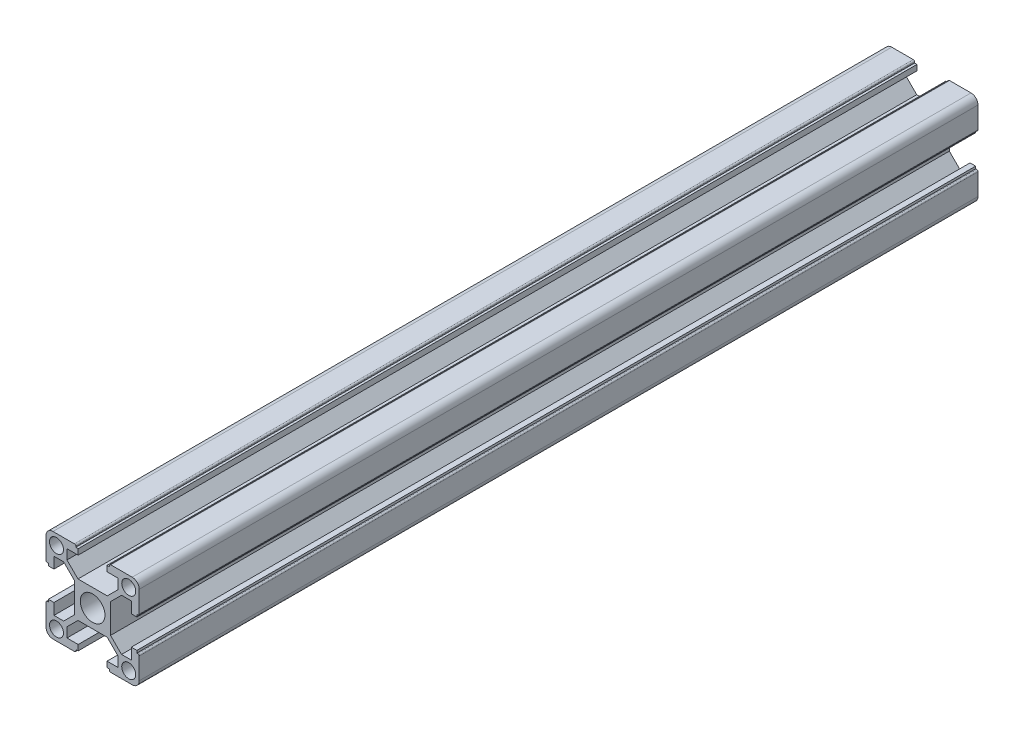
from build123d import *

# Parameters (mm, degrees)
SKETCH_1_R      = 2.65
SKETCH_1_R_2    = 1.5
EXTRUDE_1_DEPTH = 90


with BuildPart() as part:
    # 草图1 → 凸台-拉伸1 (new, symmetric)
    with BuildSketch(Plane.XY):
        with BuildLine():
            Line((3.142893219, 3.85), (-3.142893219, 3.85))
            Line((-3.142893219, 3.85), (-5.5, 6.207106781))
            Line((-5.5, 6.207106781), (-5.5, 8.3))
            Line((-5.5, 8.3), (-3.1, 8.3))
            Line((-3.1, 8.3), (-3.1, 9.5))
            Line((-3.1, 9.5), (-3.6, 9.5))
            Line((-3.6, 9.5), (-3.6, 9.7))
            ThreePointArc((-3.6, 9.7), (-3.687867966, 9.912132034), (-3.9, 10))
            Line((-3.9, 10), (-8.5, 10))
            ThreePointArc((-8.5, 10), (-9.560660172, 9.560660172), (-10, 8.5))
            Line((-10, 8.5), (-10, 3.9))
            ThreePointArc((-10, 3.9), (-9.912132034, 3.687867966), (-9.7, 3.6))
            Line((-9.7, 3.6), (-9.5, 3.6))
            Line((-9.5, 3.6), (-9.5, 3.1))
            Line((-9.5, 3.1), (-8.3, 3.1))
            Line((-8.3, 3.1), (-8.3, 5.5))
            Line((-8.3, 5.5), (-6.207106781, 5.5))
            Line((-6.207106781, 5.5), (-3.85, 3.142893219))
            Line((-3.85, 3.142893219), (-3.85, -3.142893219))
            Line((-3.85, -3.142893219), (-6.207106781, -5.5))
            Line((-6.207106781, -5.5), (-8.3, -5.5))
            Line((-8.3, -5.5), (-8.3, -3.1))
            Line((-8.3, -3.1), (-9.5, -3.1))
            Line((-9.5, -3.1), (-9.5, -3.6))
            Line((-9.5, -3.6), (-9.7, -3.6))
            ThreePointArc((-9.7, -3.6), (-9.912132034, -3.687867966), (-10, -3.9))
            Line((-10, -3.9), (-10, -8.5))
            ThreePointArc((-10, -8.5), (-9.560660172, -9.560660172), (-8.5, -10))
            Line((-8.5, -10), (-3.9, -10))
            ThreePointArc((-3.9, -10), (-3.687867966, -9.912132034), (-3.6, -9.7))
            Line((-3.6, -9.7), (-3.6, -9.5))
            Line((-3.6, -9.5), (-3.1, -9.5))
            Line((-3.1, -9.5), (-3.1, -8.3))
            Line((-3.1, -8.3), (-5.5, -8.3))
            Line((-5.5, -8.3), (-5.5, -6.207106781))
            Line((-5.5, -6.207106781), (-3.142893219, -3.85))
            Line((-3.142893219, -3.85), (3.142893219, -3.85))
            Line((3.142893219, -3.85), (5.5, -6.207106781))
            Line((5.5, -6.207106781), (5.5, -8.3))
            Line((5.5, -8.3), (3.1, -8.3))
            Line((3.1, -8.3), (3.1, -9.5))
            Line((3.1, -9.5), (3.6, -9.5))
            Line((3.6, -9.5), (3.6, -9.7))
            ThreePointArc((3.6, -9.7), (3.687867966, -9.912132034), (3.9, -10))
            Line((3.9, -10), (8.5, -10))
            ThreePointArc((8.5, -10), (9.560660172, -9.560660172), (10, -8.5))
            Line((10, -8.5), (10, -3.9))
            ThreePointArc((10, -3.9), (9.912132034, -3.687867966), (9.7, -3.6))
            Line((9.7, -3.6), (9.5, -3.6))
            Line((9.5, -3.6), (9.5, -3.1))
            Line((9.5, -3.1), (8.3, -3.1))
            Line((8.3, -3.1), (8.3, -5.5))
            Line((8.3, -5.5), (6.207106781, -5.5))
            Line((6.207106781, -5.5), (3.85, -3.142893219))
            Line((3.85, -3.142893219), (3.85, 3.142893219))
            Line((3.85, 3.142893219), (6.207106781, 5.5))
            Line((6.207106781, 5.5), (8.3, 5.5))
            Line((8.3, 5.5), (8.3, 3.1))
            Line((8.3, 3.1), (9.5, 3.1))
            Line((9.5, 3.1), (9.5, 3.6))
            Line((9.5, 3.6), (9.7, 3.6))
            ThreePointArc((9.7, 3.6), (9.912132034, 3.687867966), (10, 3.9))
            Line((10, 3.9), (10, 8.5))
            ThreePointArc((10, 8.5), (9.560660172, 9.560660172), (8.5, 10))
            Line((8.5, 10), (3.9, 10))
            ThreePointArc((3.9, 10), (3.687867966, 9.912132034), (3.6, 9.7))
            Line((3.6, 9.7), (3.6, 9.5))
            Line((3.6, 9.5), (3.1, 9.5))
            Line((3.1, 9.5), (3.1, 8.3))
            Line((3.1, 8.3), (5.5, 8.3))
            Line((5.5, 8.3), (5.5, 6.207106781))
            Line((5.5, 6.207106781), (3.142893219, 3.85))
        make_face()
        with Locations(Location((0, 0, 0), (0, 0, 180))):
            Circle(SKETCH_1_R, mode=Mode.SUBTRACT)
        with Locations(Location((-7.75, 7.75, 0), (0, 0, 180))):
            Circle(SKETCH_1_R_2, mode=Mode.SUBTRACT)
        with Locations(Location((7.75, 7.75, 0), (0, 0, 180))):
            Circle(SKETCH_1_R_2, mode=Mode.SUBTRACT)
        with Locations(Location((7.75, -7.75, 0), (0, 0, 180))):
            Circle(SKETCH_1_R_2, mode=Mode.SUBTRACT)
        with Locations(Location((-7.75, -7.75, 0), (0, 0, 180))):
            Circle(SKETCH_1_R_2, mode=Mode.SUBTRACT)
    extrude(amount=EXTRUDE_1_DEPTH, both=True)


solid = part.part
